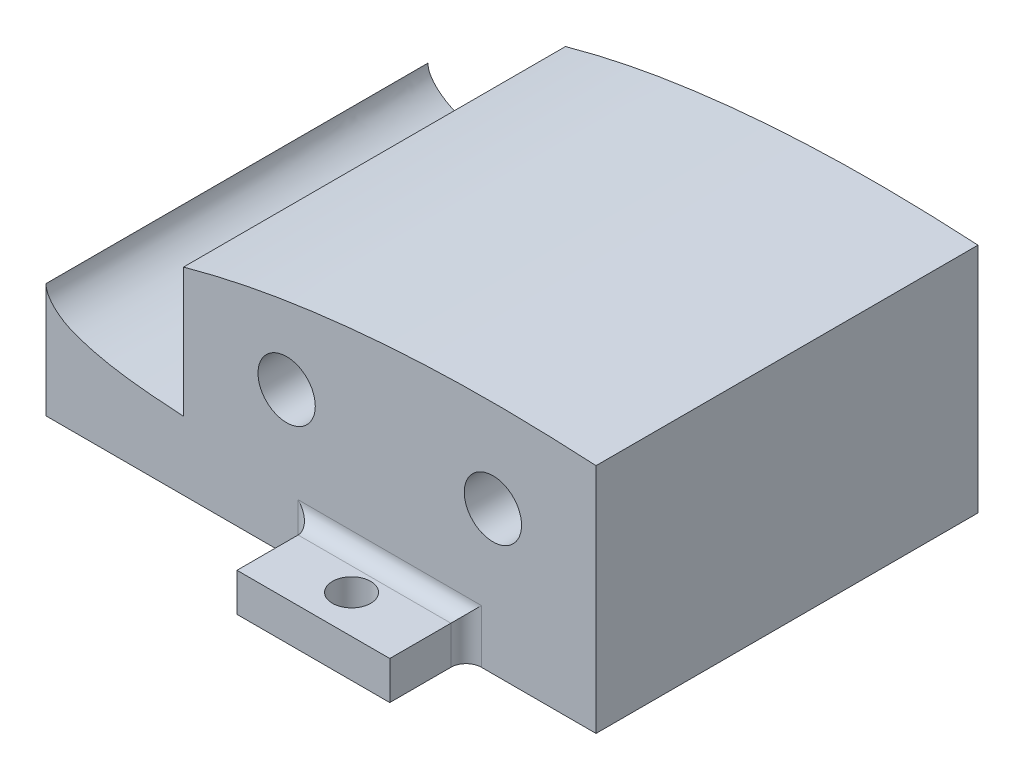
from build123d import *

# Parameters (mm, degrees)
BOSS_EXTRUDE2_DEPTH      = 31.75
BOSS_EXTRUDE2_DEPTH_BACK = 31.75
SKETCH6_R                = 4.7625
SKETCH7_W                = 25.4
SKETCH7_H                = 12.7
SKETCH7_R                = 3.175
BOSS_EXTRUDE3_DEPTH      = 6.35
FILLET2_R                = 2.54


with BuildPart() as part:
    # Sketch6 → Boss-Extrude2 (new, two sides: drawn at the far end of the back side and taken through both)
    with BuildSketch(Plane.XY.offset(-BOSS_EXTRUDE2_DEPTH_BACK)):
        with BuildLine():
            Line((0, 0), (0, -19.05))
            Line((0, -19.05), (91.44, -19.05))
            Line((91.44, -19.05), (91.44, 19.508873689))
            add(Edge.make_bspline(
                [(91.44, 19.508873689), (84.035620806, 19.934056268), (72.792017375, 20.223197155), (57.72640102, 19.576586177), (46.241137994, 18.487194162), (34.713862172, 16.738987134), (26.950784486, 14.94277721), (23.006436851, 13.850652949), (22.86, 13.80984362)],
                knots=[0.299041321, 0.299041321, 0.299041321, 0.299041321, 0.346600594, 0.371102737, 0.395726297, 0.420570145, 0.445825119, 0.446799337, 0.446799337, 0.446799337, 0.446799337], degree=3))
            Line((22.86, 13.80984362), (22.86, -7.674303273))
            add(Edge.make_bspline(
                [(0, 0), (0, -0.17867716), (0.134938936, -1.688448649), (2.416021962, -3.935922156), (6.457030189, -5.50998662), (11.289417386, -6.62752917), (17.013896112, -7.281283102), (20.870897646, -7.562814069), (22.817971884, -7.671962522), (22.86, -7.674303273)],
                knots=[0.505625693, 0.505625693, 0.505625693, 0.505625693, 0.506863029, 0.51614777, 0.522766003, 0.535269014, 0.547551134, 0.559786371, 0.560056294, 0.560056294, 0.560056294, 0.560056294], degree=3))
        make_face()
        with Locations((40.005, 4.734594188)):
            Circle(SKETCH6_R, mode=Mode.SUBTRACT)
        with Locations((74.295, 4.734594188)):
            Circle(SKETCH6_R, mode=Mode.SUBTRACT)
    extrude(amount=BOSS_EXTRUDE2_DEPTH + BOSS_EXTRUDE2_DEPTH_BACK)

    # Sketch7 → Boss-Extrude3 (add)
    # profile 1 of 2: a face of its own
    with BuildSketch(Plane.XZ.offset(19.05)):
        with Locations((57.15, 38.1)):
            Rectangle(SKETCH7_W, SKETCH7_H)
        with Locations((57.15, 38.1)):
            Circle(SKETCH7_R, mode=Mode.SUBTRACT)
    # profile 2 of 2: a face of its own
    with BuildSketch(Plane.XZ.offset(19.05)):
        with Locations((57.15, -38.1)):
            Rectangle(SKETCH7_W, SKETCH7_H)
        with Locations((57.15, -38.1)):
            Circle(SKETCH7_R, mode=Mode.SUBTRACT)
    extrude(amount=-BOSS_EXTRUDE3_DEPTH)

    # Fillet2
    fillet2_edges = [part.edges().sort_by_distance(p)[0] for p in [
        (57.15, -12.7, 31.75),
        (44.45, -15.875, 31.75),
        (69.85, -15.875, 31.75),
        (57.15, -12.7, -31.75),
        (69.85, -15.875, -31.75),
        (44.45, -15.875, -31.75),
    ]]
    fillet(fillet2_edges, radius=FILLET2_R)


solid = part.part
